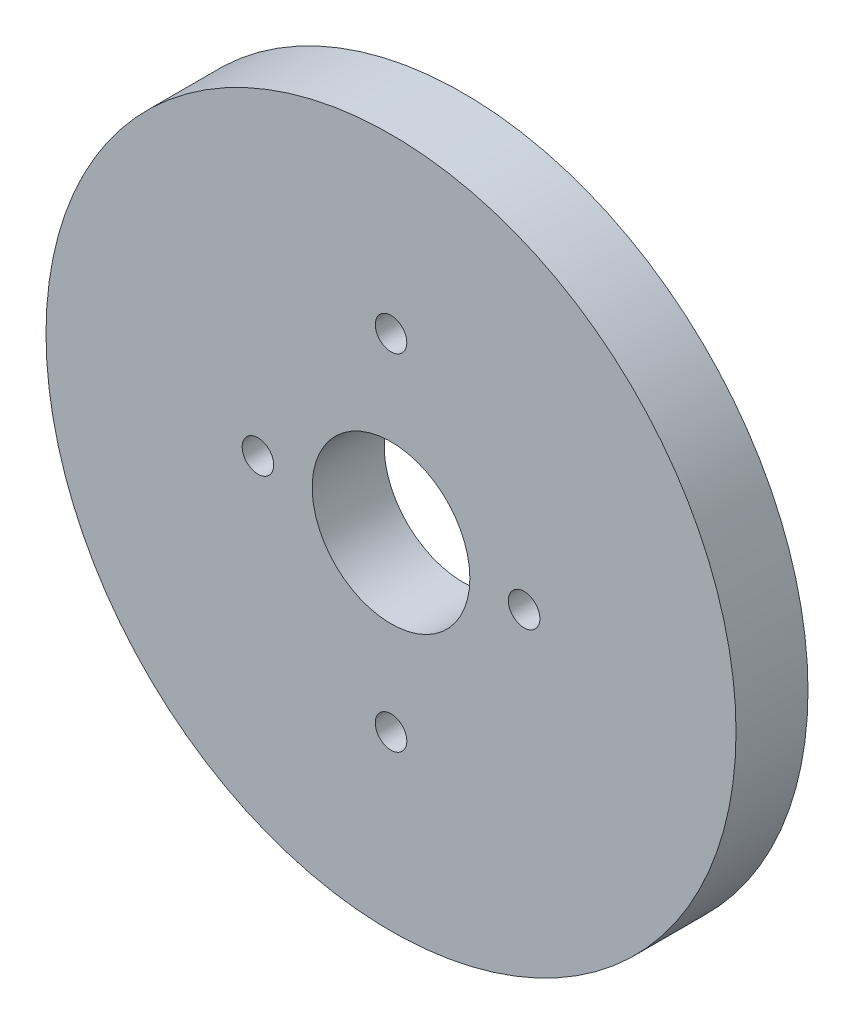
from build123d import *

# Parameters (mm, degrees)
SKETCH1_R           = 17.5
SKETCH1_R_2         = 4
SKETCH1_R_3         = 0.8
BOSS_EXTRUDE1_DEPTH = 3.65


with BuildPart() as part:
    # Sketch1 → Boss-Extrude1 (new body)
    with BuildSketch(Plane.XY):
        Circle(SKETCH1_R)
        Circle(SKETCH1_R_2, mode=Mode.SUBTRACT)
        with Locations((6.75, 0)):
            Circle(SKETCH1_R_3, mode=Mode.SUBTRACT)
        with Locations((0, 8.75)):
            Circle(SKETCH1_R_3, mode=Mode.SUBTRACT)
        with Locations(Location((0, -8.75, 0), (0, 0, 180))):
            Circle(SKETCH1_R_3, mode=Mode.SUBTRACT)
        with Locations(Location((-6.75, 0, 0), (0, 0, 180))):
            Circle(SKETCH1_R_3, mode=Mode.SUBTRACT)
    extrude(amount=BOSS_EXTRUDE1_DEPTH)


solid = part.part
